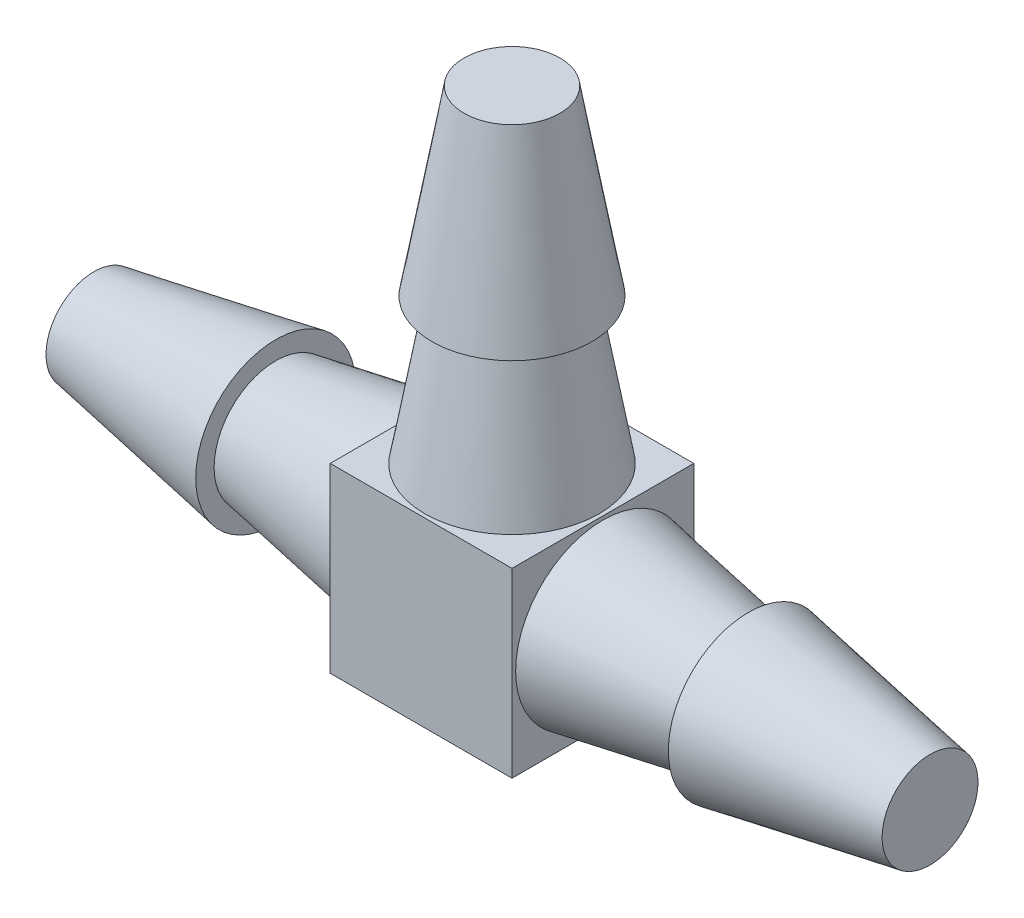
from build123d import *

# Parameters (mm, degrees)
ESQUISSE1_W      = 5
ESQUISSE1_H      = 5
EXTRUSION1_DEPTH = 5
ESQUISSE2_R      = 2.4
EXTRUSION2_DEPTH = 4
EXTRUSION2_TAPER = 10
ESQUISSE3_R      = 2.4
EXTRUSION3_DEPTH = 4
EXTRUSION3_TAPER = 10
ESQUISSE4_R      = 2.4
EXTRUSION4_DEPTH = 4
EXTRUSION4_TAPER = 10
ESQUISSE5_R      = 2.2
EXTRUSION5_DEPTH = 5
EXTRUSION5_TAPER = 10
ESQUISSE6_R      = 2.2
EXTRUSION6_DEPTH = 5
EXTRUSION6_TAPER = 10
ESQUISSE7_R      = 2.2
EXTRUSION7_DEPTH = 5
EXTRUSION7_TAPER = 10


with BuildPart() as part:
    # Esquisse1 → Extrusion1 (new body)
    with BuildSketch(Plane.XY):
        with Locations((-16.829438543, -10.768512898)):
            Rectangle(ESQUISSE1_W, ESQUISSE1_H)
    extrude(amount=EXTRUSION1_DEPTH)

    # Esquisse2 → Extrusion2 (add)
    with BuildSketch(Plane(origin=(-14.329438543, 0, 0), x_dir=(0, 0, -1), z_dir=(1, 0, 0))):
        with Locations((-2.5, -10.768512898)):
            Circle(ESQUISSE2_R)
    extrude(amount=EXTRUSION2_DEPTH, taper=EXTRUSION2_TAPER)

    # Esquisse3 → Extrusion3 (add)
    with BuildSketch(Plane(origin=(0, -8.268512898, 0), x_dir=(-1, 0, 0), z_dir=(0, 1, 0))):
        with Locations((16.829438543, 2.5)):
            Circle(ESQUISSE3_R)
    extrude(amount=EXTRUSION3_DEPTH, taper=EXTRUSION3_TAPER)

    # Esquisse4 → Extrusion4 (add)
    with BuildSketch(Plane.ZY.offset(19.329438543)):
        with Locations((2.5, -10.768512898)):
            Circle(ESQUISSE4_R)
    extrude(amount=EXTRUSION4_DEPTH, taper=EXTRUSION4_TAPER)

    # Esquisse5 → Extrusion5 (add)
    with BuildSketch(Plane.ZY.offset(23.329438543)):
        with Locations((2.5, -10.768512898)):
            Circle(ESQUISSE5_R)
    extrude(amount=EXTRUSION5_DEPTH, taper=EXTRUSION5_TAPER)

    # Esquisse6 → Extrusion6 (add)
    with BuildSketch(Plane(origin=(0, -4.268512898, 0), x_dir=(-1, 0, 0), z_dir=(0, 1, 0))):
        with Locations((16.829438543, 2.5)):
            Circle(ESQUISSE6_R)
    extrude(amount=EXTRUSION6_DEPTH, taper=EXTRUSION6_TAPER)

    # Esquisse7 → Extrusion7 (add)
    with BuildSketch(Plane(origin=(-10.329438543, 0, 0), x_dir=(0, 0, -1), z_dir=(1, 0, 0))):
        with Locations((-2.5, -10.768512898)):
            Circle(ESQUISSE7_R)
    extrude(amount=EXTRUSION7_DEPTH, taper=EXTRUSION7_TAPER)


solid = part.part
